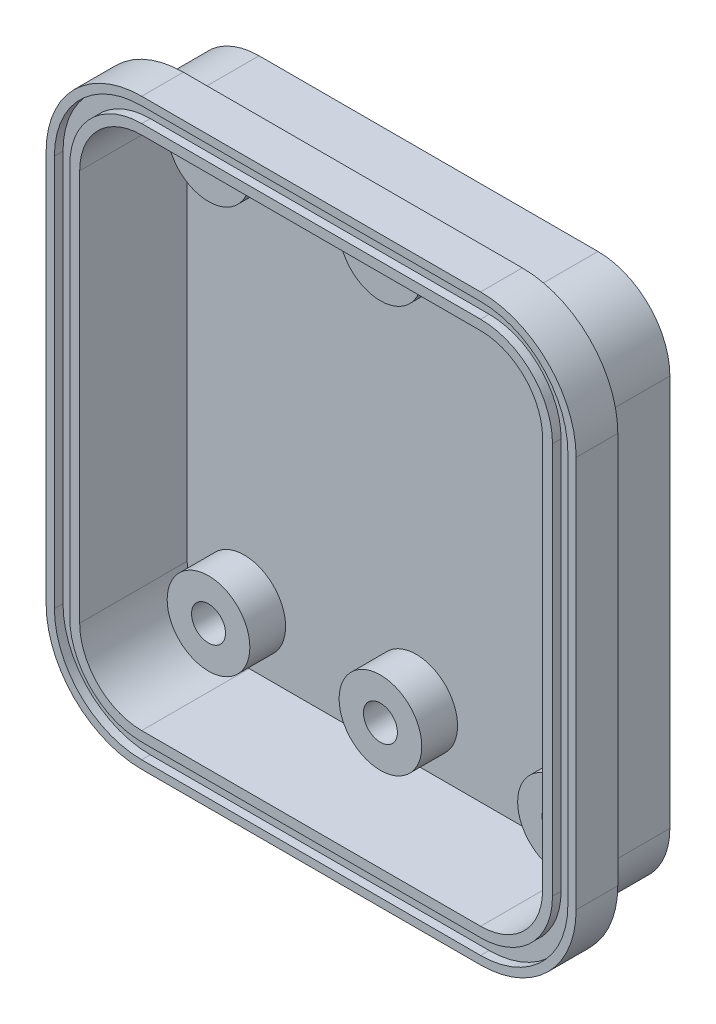
from build123d import *

# Parameters (mm, degrees)
BOSS_EXTRUDE1_DEPTH  = 16.51
SHELL1_T             = 1.524
SKETCH2_R            = 6.35
SKETCH2_R_2          = 2.608000118
BOSS_EXTRUDE2_DEPTH  = 5.5
BOSS_EXTRUDE9_DEPTH  = 1.3208
BOSS_EXTRUDE10_START = 5.08
BOSS_EXTRUDE10_DEPTH = 5.08


with BuildPart() as part:
    # Sketch1 → Boss-Extrude1 (new body)
    with BuildSketch(Plane.XY):
        with BuildLine():
            Line((26.034999985, 143.509994751), (78.104997498, 143.509994751))
            ThreePointArc((78.104997498, 143.509994751), (84.840189588, 140.720186842), (87.629997498, 133.984994751))
            Line((87.629997498, 133.984994751), (87.629997498, 73.787000793))
            ThreePointArc((87.629997498, 73.787000793), (84.840189588, 67.051808703), (78.104997498, 64.262000793))
            Line((78.104997498, 64.262000793), (26.034999985, 64.262000793))
            ThreePointArc((26.034999985, 64.262000793), (19.299807894, 67.051808703), (16.509999985, 73.787000793))
            Line((16.509999985, 73.787000793), (16.509999985, 133.984994751))
            ThreePointArc((16.509999985, 133.984994751), (19.299807894, 140.720186842), (26.034999985, 143.509994751))
        make_face()
    extrude(amount=BOSS_EXTRUDE1_DEPTH)

    # Shell1
    shell1_openings = [part.faces().sort_by_distance(p)[0] for p in [
        (52.069998741, 103.885997772, 16.51),
    ]]
    offset(amount=SHELL1_T, openings=shell1_openings, kind=Kind.INTERSECTION)

    # Sketch2 → Boss-Extrude2 (add)
    # profile 1 of 6: a face of its own
    with BuildSketch(Plane.XY):
        with Locations(Location((25.292, 135.128, 0), (0, 0, 180))):
            Circle(SKETCH2_R)
        with Locations((25.292, 135.128)):
            Circle(SKETCH2_R_2, mode=Mode.SUBTRACT)
    # profile 2 of 6: a face of its own
    with BuildSketch(Plane.XY):
        with Locations(Location((51.708, 135.128, 0), (0, 0, 180))):
            Circle(SKETCH2_R)
        with Locations((51.708, 135.128)):
            Circle(SKETCH2_R_2, mode=Mode.SUBTRACT)
    # profile 3 of 6: a face of its own
    with BuildSketch(Plane.XY):
        with Locations(Location((79.14, 135.128, 0), (0, 0, 180))):
            Circle(SKETCH2_R)
        with Locations((79.14, 135.128)):
            Circle(SKETCH2_R_2, mode=Mode.SUBTRACT)
    # profile 4 of 6: a face of its own
    with BuildSketch(Plane.XY):
        with Locations(Location((25.292, 72.644, 0), (0, 0, 180))):
            Circle(SKETCH2_R)
        with Locations((25.292, 72.644)):
            Circle(SKETCH2_R_2, mode=Mode.SUBTRACT)
    # profile 5 of 6: a face of its own
    with BuildSketch(Plane.XY):
        with Locations(Location((51.708, 72.644, 0), (0, 0, 180))):
            Circle(SKETCH2_R)
        with Locations((51.708, 72.644)):
            Circle(SKETCH2_R_2, mode=Mode.SUBTRACT)
    # profile 6 of 6: a face of its own
    with BuildSketch(Plane.XY):
        with Locations(Location((79.14, 72.644, 0), (0, 0, 180))):
            Circle(SKETCH2_R)
        with Locations((79.14, 72.644)):
            Circle(SKETCH2_R_2, mode=Mode.SUBTRACT)
    extrude(amount=BOSS_EXTRUDE2_DEPTH)



with BuildPart() as body_2:
    # Sketch7 → Boss-Extrude9 (new body)
    with BuildSketch(Plane.XY.offset(16.51)):
        with BuildLine():
            Line((92.786197498, 73.787000793), (92.786197498, 133.984994751))
            ThreePointArc((92.786197498, 133.984994751), (88.486173574, 144.366170827), (78.104997498, 148.666194751))
            Line((78.104997498, 148.666194751), (26.034999985, 148.666194751))
            ThreePointArc((26.034999985, 148.666194751), (15.653823909, 144.366170827), (11.353799985, 133.984994751))
            Line((11.353799985, 133.984994751), (11.353799985, 73.787000793))
            ThreePointArc((11.353799985, 73.787000793), (15.653823909, 63.405824718), (26.034999985, 59.105800793))
            Line((26.034999985, 59.105800793), (78.104997498, 59.105800793))
            ThreePointArc((78.104997498, 59.105800793), (88.486173574, 63.405824718), (92.786197498, 73.787000793))
        make_face()
        with BuildLine():
            ThreePointArc((26.034999985, 147.396194751), (16.551849521, 143.468145215), (12.623799985, 133.984994751))
            Line((12.623799985, 133.984994751), (12.623799985, 73.787000793))
            ThreePointArc((12.623799985, 73.787000793), (16.551849521, 64.30385033), (26.034999985, 60.375800793))
            Line((26.034999985, 60.375800793), (78.104997498, 60.375800793))
            ThreePointArc((78.104997498, 60.375800793), (87.588147961, 64.30385033), (91.516197498, 73.787000793))
            Line((91.516197498, 73.787000793), (91.516197498, 133.984994751))
            ThreePointArc((91.516197498, 133.984994751), (87.588147961, 143.468145215), (78.104997498, 147.396194751))
            Line((78.104997498, 147.396194751), (26.034999985, 147.396194751))
        make_face(mode=Mode.SUBTRACT)
    extrude(amount=-BOSS_EXTRUDE9_DEPTH)


with BuildPart() as part_1:
    add(part.part)

    add(body_2.part)  # Boss-Extrude10 merges body 2
    # Sketch8 → Boss-Extrude10 (add)
    # profile 1 of 2: a face of its own
    with BuildSketch(Plane(origin=(0, 0, 15.1892), x_dir=(-1, 0, 0), z_dir=(0, 0, -1)).offset(BOSS_EXTRUDE10_START)):
        with BuildLine():
            ThreePointArc((-78.104997498, 148.666194751), (-88.486173574, 144.366170827), (-92.786197498, 133.984994751))
            Line((-92.786197498, 133.984994751), (-92.786197498, 73.787000793))
            ThreePointArc((-92.786197498, 73.787000793), (-88.486173574, 63.405824718), (-78.104997498, 59.105800793))
            Line((-78.104997498, 59.105800793), (-26.034999985, 59.105800793))
            ThreePointArc((-26.034999985, 59.105800793), (-15.653823909, 63.405824718), (-11.353799985, 73.787000793))
            Line((-11.353799985, 73.787000793), (-11.353799985, 133.984994751))
            ThreePointArc((-11.353799985, 133.984994751), (-15.653823909, 144.366170827), (-26.034999985, 148.666194751))
            Line((-26.034999985, 148.666194751), (-78.104997498, 148.666194751))
        make_face()
        with BuildLine():
            Line((-78.104997498, 147.396194751), (-26.034999985, 147.396194751))
            ThreePointArc((-26.034999985, 147.396194751), (-16.551849521, 143.468145215), (-12.623799985, 133.984994751))
            Line((-12.623799985, 133.984994751), (-12.623799985, 73.787000793))
            ThreePointArc((-12.623799985, 73.787000793), (-16.551849521, 64.30385033), (-26.034999985, 60.375800793))
            Line((-26.034999985, 60.375800793), (-78.104997498, 60.375800793))
            ThreePointArc((-78.104997498, 60.375800793), (-87.588147961, 64.30385033), (-91.516197498, 73.787000793))
            Line((-91.516197498, 73.787000793), (-91.516197498, 133.984994751))
            ThreePointArc((-91.516197498, 133.984994751), (-87.588147961, 143.468145215), (-78.104997498, 147.396194751))
        make_face(mode=Mode.SUBTRACT)
    # profile 2 of 2: a face of its own
    with BuildSketch(Plane(origin=(0, 0, 15.1892), x_dir=(-1, 0, 0), z_dir=(0, 0, -1)).offset(BOSS_EXTRUDE10_START)):
        with BuildLine():
            ThreePointArc((-26.034999985, 147.396194751), (-16.551849521, 143.468145215), (-12.623799985, 133.984994751))
            Line((-12.623799985, 133.984994751), (-12.623799985, 73.787000793))
            ThreePointArc((-12.623799985, 73.787000793), (-16.551849521, 64.30385033), (-26.034999985, 60.375800793))
            Line((-26.034999985, 60.375800793), (-78.104997498, 60.375800793))
            ThreePointArc((-78.104997498, 60.375800793), (-87.588147961, 64.30385033), (-91.516197498, 73.787000793))
            Line((-91.516197498, 73.787000793), (-91.516197498, 133.984994751))
            ThreePointArc((-91.516197498, 133.984994751), (-87.588147961, 143.468145215), (-78.104997498, 147.396194751))
            Line((-78.104997498, 147.396194751), (-26.034999985, 147.396194751))
        make_face()
        with BuildLine():
            ThreePointArc((-26.034999985, 62.738000793), (-18.222177159, 65.974177968), (-14.985999985, 73.787000793))
            Line((-14.985999985, 73.787000793), (-14.985999985, 133.984994751))
            ThreePointArc((-14.985999985, 133.984994751), (-18.222177159, 141.797817576), (-26.034999985, 145.033994751))
            Line((-26.034999985, 145.033994751), (-78.104997498, 145.033994751))
            ThreePointArc((-78.104997498, 145.033994751), (-85.917820323, 141.797817576), (-89.153997498, 133.984994751))
            Line((-89.153997498, 133.984994751), (-89.153997498, 73.787000793))
            ThreePointArc((-89.153997498, 73.787000793), (-85.917820323, 65.974177968), (-78.104997498, 62.738000793))
            Line((-78.104997498, 62.738000793), (-26.034999985, 62.738000793))
        make_face(mode=Mode.SUBTRACT)
    extrude(amount=-BOSS_EXTRUDE10_DEPTH)


solid = part_1.part
